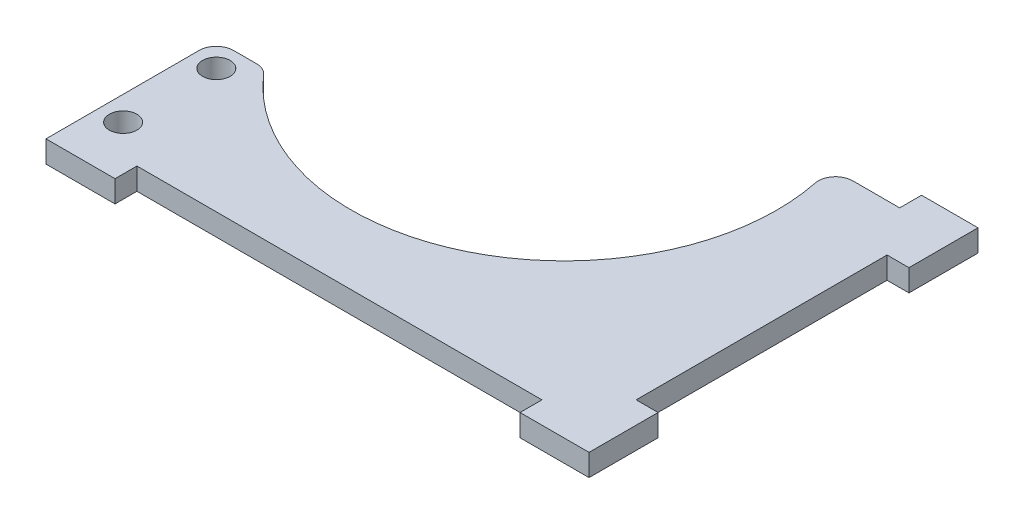
from build123d import *

# Parameters (mm, degrees)
SKETCH1_R           = 4
BOSS_EXTRUDE1_DEPTH = 3.175
FILLET1_R           = 5


with BuildPart() as part:
    # Sketch1 → Boss-Extrude1 (new, symmetric)
    with BuildSketch(Plane(origin=(0, 0, 0), x_dir=(1, 0, 0), z_dir=(0, 1, 0))):
        with BuildLine():
            Line((-78.675, -56.35), (-58.675, -56.35))
            Line((-58.675, -56.35), (-58.675, -50))
            Line((-58.675, -50), (58.675, -50))
            Line((58.675, -50), (58.675, -56.35))
            Line((58.675, -56.35), (78.675, -56.35))
            Line((78.675, -56.35), (78.675, -36.35))
            Line((78.675, -36.35), (72.325, -36.35))
            Line((72.325, -36.35), (72.325, 36.35))
            Line((72.325, 36.35), (78.675, 36.35))
            Line((78.675, 36.35), (78.675, 56.35))
            Line((78.675, 56.35), (62.325, 56.35))
            Line((62.325, 56.35), (62.325, 50))
            Line((62.325, 50), (42.325, 50))
            ThreePointArc((42.325, 50), (12.399475155, -22.753839327), (-64.675, -7))
            Line((-64.675, -7), (-78.675, -7))
            Line((-78.675, -7), (-78.675, -56.35))
        make_face()
        with Locations(Location((-71.675, -41, 0), (0, 0, 270))):
            Circle(SKETCH1_R, mode=Mode.SUBTRACT)
        with Locations(Location((-71.675, -14, 0), (0, 0, 270))):
            Circle(SKETCH1_R, mode=Mode.SUBTRACT)
    extrude(amount=BOSS_EXTRUDE1_DEPTH, both=True)

    # Fillet1
    fillet1_edges = [part.edges().sort_by_distance(p)[0] for p in [
        (-78.675, 0, 7),
        (-64.675, 0, 7),
        (42.325, 0, -50),
    ]]
    fillet(fillet1_edges, radius=FILLET1_R)


solid = part.part
